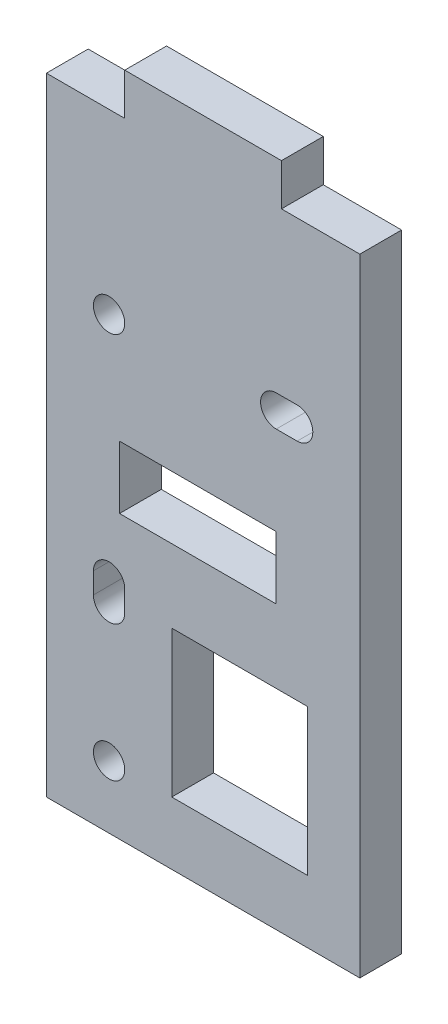
from build123d import *

# Parameters (mm, degrees)
SKETCH1_R           = 1.5
SKETCH1_W           = 13
SKETCH1_H           = 14
SKETCH1_W_2         = 15
SKETCH1_H_2         = 6
BOSS_EXTRUDE1_DEPTH = 4


with BuildPart() as part:
    # Sketch1 → Boss-Extrude1 (new body)
    with BuildSketch(Plane.XY):
        Polygon((0, 0), (30, 0), (30, 60), (22.5, 60), (22.5, 64), (7.5, 64), (7.5, 60), (0, 60), align=None)
        with Locations((6, 6)):
            Circle(SKETCH1_R, mode=Mode.SUBTRACT)
        with Locations((6, 43)):
            Circle(SKETCH1_R, mode=Mode.SUBTRACT)
        with Locations((18.5, 13)):
            Rectangle(SKETCH1_W, SKETCH1_H, mode=Mode.SUBTRACT)
        with Locations((14.5, 30)):
            Rectangle(SKETCH1_W_2, SKETCH1_H_2, mode=Mode.SUBTRACT)
        with BuildLine():
            Line((7.5, 21), (7.5, 19))
            ThreePointArc((7.5, 19), (6, 17.5), (4.5, 19))
            Line((4.5, 19), (4.5, 21))
            ThreePointArc((4.5, 21), (6, 22.5), (7.5, 21))
        make_face(mode=Mode.SUBTRACT)
        with BuildLine():
            Line((22, 44.5), (24, 44.5))
            ThreePointArc((24, 44.5), (25.5, 43), (24, 41.5))
            Line((24, 41.5), (22, 41.5))
            ThreePointArc((22, 41.5), (20.5, 43), (22, 44.5))
        make_face(mode=Mode.SUBTRACT)
    extrude(amount=BOSS_EXTRUDE1_DEPTH)


solid = part.part
